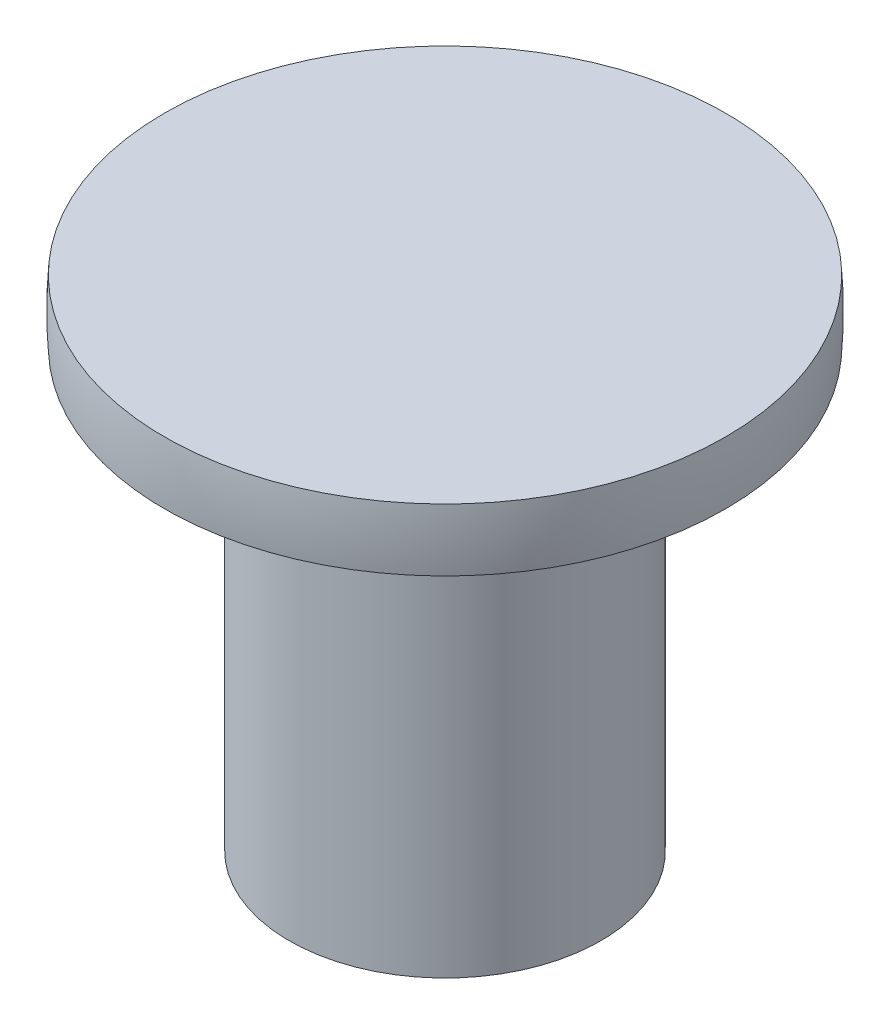
from build123d import *


with BuildPart() as part:
    # Sketch1 → Revolve1 (revolve)
    with BuildSketch(Plane.XY, mode=Mode.PRIVATE) as revolve1_sk:
        with BuildLine():
            Line((0, 8), (0, 4.5))
            Line((0, 4.5), (1.8, 4.5))
            Line((1.8, 4.5), (1.8, 0))
            Line((1.8, 0), (2.5, 0))
            Line((2.5, 0), (2.5, 7))
            Line((2.5, 7), (4.5, 7))
            ThreePointArc((4.5, 7), (4.519244001, 7.5), (4.5, 8))
            Line((4.5, 8), (0, 8))
        make_face()
    revolve(revolve1_sk.sketch.rotate(Axis((0, 8, 0), (0, -1, 0)), 180), axis=Axis((0, 8, 0), (0, -1, 0)))


solid = part.part
